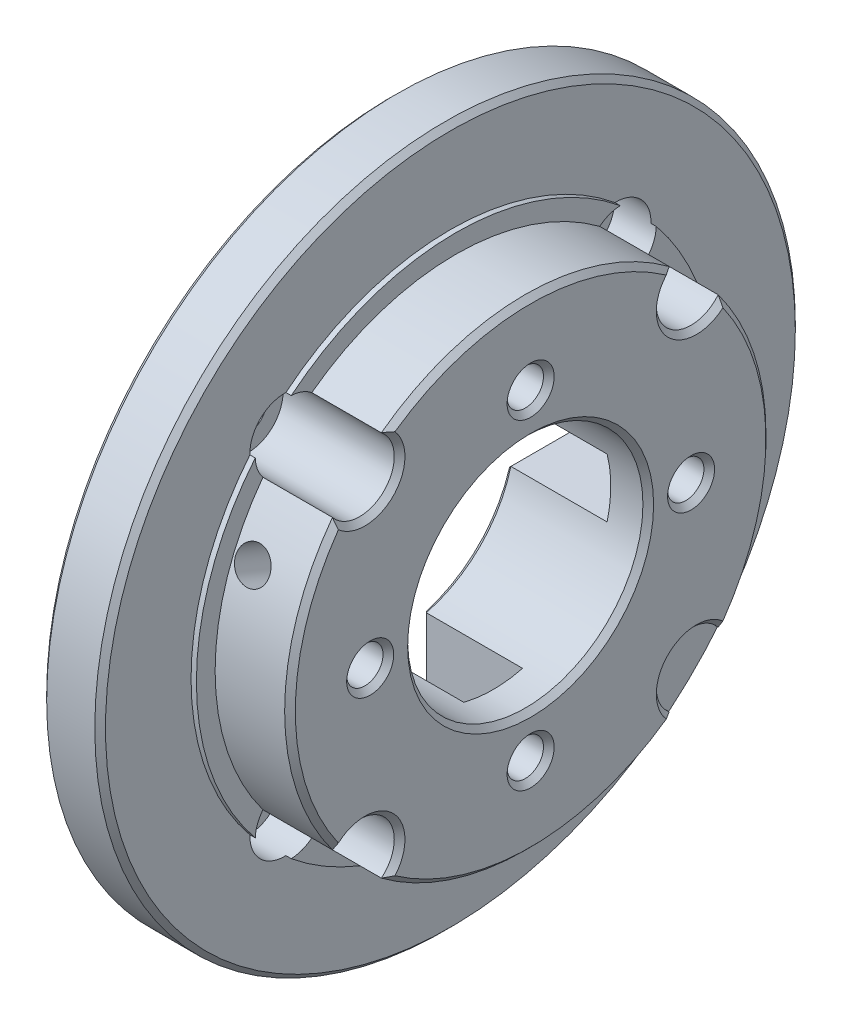
from build123d import *

# Parameters (mm, degrees)
M3_CLEARANCE_HOLE1_D                                = 3.4
SKETCH6_R                                           = 1.7
CUT_EXTRUDE1_DEPTH                                  = 9.5
CUT_EXTRUDE2_REACH                                  = 50.105
SKETCH7_R                                           = 3.25
CBORE_FOR_M3_HEX_SOCKET_HEAD_CAP_SCREW1_D           = 3.4
CBORE_FOR_M3_HEX_SOCKET_HEAD_CAP_SCREW1_CBORE_D     = 6.5
CBORE_FOR_M3_HEX_SOCKET_HEAD_CAP_SCREW1_CBORE_DEPTH = 3.4
CUT_EXTRUDE3_REACH                                  = 70.891
SKETCH12_R                                          = 1.6
CHAMFER1_SIZE                                       = 0.5


with BuildPart() as part:
    # Sketch1 → Revolve1 (revolve)
    with BuildSketch(Plane.XY, mode=Mode.PRIVATE) as revolve1_sk:
        Polygon((0, 32.75), (0, 11), (13, 11), (13, 22.5), (6, 22.5), (6, 24.25), (5.5, 24.25), (5.5, 32.75), align=None)
    revolve(revolve1_sk.sketch.rotate(Axis((0, 0, 0), (1, 0, 0)), 90), axis=Axis((0, 0, 0), (1, 0, 0)))

    # M3 Clearance Hole1 (through all)
    with Locations(Plane(origin=(13, 0, 0), x_dir=(0, 0, -1), z_dir=(1, 0, 0))):
        with Locations((0, 15), (15, 0), (0, -15), (-15, 0)):
            Hole(M3_CLEARANCE_HOLE1_D / 2)

    # Sketch6 → Cut-Extrude1 (cut)
    # profile 1 of 4: a face of its own
    with BuildSketch(Plane.ZY):
        with BuildLine():
            Line((2.75, 10.650704202), (2.75, 16.58771324))
            Line((2.75, 16.58771324), (0, 18.175426481))
            Line((0, 18.175426481), (-2.75, 16.58771324))
            Line((-2.75, 16.58771324), (-2.75, 10.650704202))
            ThreePointArc((-2.75, 10.650704202), (0, 11), (2.75, 10.650704202))
        make_face()
        with Locations(Location((0, 15, 0), (0, 0, 180))):
            Circle(SKETCH6_R, mode=Mode.SUBTRACT)
    # profile 2 of 4: a face of its own
    with BuildSketch(Plane.ZY):
        with BuildLine():
            ThreePointArc((-10.650704202, -2.75), (-11, 0), (-10.650704202, 2.75))
            Line((-10.650704202, 2.75), (-16.58771324, 2.75))
            Line((-16.58771324, 2.75), (-18.175426481, 0))
            Line((-18.175426481, 0), (-16.58771324, -2.75))
            Line((-16.58771324, -2.75), (-10.650704202, -2.75))
        make_face()
        with Locations(Location((-15, 0, 0), (0, 0, 180))):
            Circle(SKETCH6_R, mode=Mode.SUBTRACT)
    # profile 3 of 4: a face of its own
    with BuildSketch(Plane.ZY):
        with BuildLine():
            ThreePointArc((10.650704202, 2.75), (11, 0), (10.650704202, -2.75))
            Line((10.650704202, -2.75), (16.58771324, -2.75))
            Line((16.58771324, -2.75), (18.175426481, 0))
            Line((18.175426481, 0), (16.58771324, 2.75))
            Line((16.58771324, 2.75), (10.650704202, 2.75))
        make_face()
        with Locations(Location((15, 0, 0), (0, 0, 180))):
            Circle(SKETCH6_R, mode=Mode.SUBTRACT)
    # profile 4 of 4: a face of its own
    with BuildSketch(Plane.ZY):
        with BuildLine():
            ThreePointArc((2.75, -10.650704202), (0, -11), (-2.75, -10.650704202))
            Line((-2.75, -10.650704202), (-2.75, -16.58771324))
            Line((-2.75, -16.58771324), (0, -18.175426481))
            Line((0, -18.175426481), (2.75, -16.58771324))
            Line((2.75, -16.58771324), (2.75, -10.650704202))
        make_face()
        with Locations(Location((0, -15, 0), (0, 0, 180))):
            Circle(SKETCH6_R, mode=Mode.SUBTRACT)
    extrude(amount=-CUT_EXTRUDE1_DEPTH, mode=Mode.SUBTRACT)

    # Cut-Extrude2: up to this face of the body (flat: up to its plane)
    cut_extrude2_end = Plane(part.part.faces().sort_by_distance((5.5, 0, -25.176309883))[0])
    # Sketch7 → Cut-Extrude2 (cut, up to the picked face)
    with BuildSketch(Plane(origin=(13, 0, 0), x_dir=(0, 0, -1), z_dir=(1, 0, 0)), mode=Mode.PRIVATE) as cut_extrude2_sk1:
        with Locations((-15.5, 15.5)):
            Circle(SKETCH7_R)
    cut_extrude2_tool1 = split(extrude(cut_extrude2_sk1.sketch, amount=-CUT_EXTRUDE2_REACH, mode=Mode.PRIVATE), bisect_by=cut_extrude2_end, keep=Keep.BOTH, mode=Mode.PRIVATE)
    # Sketch7 → Cut-Extrude2 (cut, up to the picked face)
    with BuildSketch(Plane(origin=(13, 0, 0), x_dir=(0, 0, -1), z_dir=(1, 0, 0)), mode=Mode.PRIVATE) as cut_extrude2_sk2:
        with Locations((-15.5, -15.5)):
            Circle(SKETCH7_R)
    cut_extrude2_tool2 = split(extrude(cut_extrude2_sk2.sketch, amount=-CUT_EXTRUDE2_REACH, mode=Mode.PRIVATE), bisect_by=cut_extrude2_end, keep=Keep.BOTH, mode=Mode.PRIVATE)
    # Sketch7 → Cut-Extrude2 (cut, up to the picked face)
    with BuildSketch(Plane(origin=(13, 0, 0), x_dir=(0, 0, -1), z_dir=(1, 0, 0)), mode=Mode.PRIVATE) as cut_extrude2_sk3:
        with Locations((15.5, -15.5)):
            Circle(SKETCH7_R)
    cut_extrude2_tool3 = split(extrude(cut_extrude2_sk3.sketch, amount=-CUT_EXTRUDE2_REACH, mode=Mode.PRIVATE), bisect_by=cut_extrude2_end, keep=Keep.BOTH, mode=Mode.PRIVATE)
    # Sketch7 → Cut-Extrude2 (cut, up to the picked face)
    with BuildSketch(Plane(origin=(13, 0, 0), x_dir=(0, 0, -1), z_dir=(1, 0, 0)), mode=Mode.PRIVATE) as cut_extrude2_sk4:
        with Locations((15.5, 15.5)):
            Circle(SKETCH7_R)
    cut_extrude2_tool4 = split(extrude(cut_extrude2_sk4.sketch, amount=-CUT_EXTRUDE2_REACH, mode=Mode.PRIVATE), bisect_by=cut_extrude2_end, keep=Keep.BOTH, mode=Mode.PRIVATE)
    add(cut_extrude2_tool1.solids().sort_by(Axis((13, 15.5, 15.5), (-1, 0, 0)))[0], mode=Mode.SUBTRACT)
    add(cut_extrude2_tool2.solids().sort_by(Axis((13, -15.5, 15.5), (-1, 0, 0)))[0], mode=Mode.SUBTRACT)
    add(cut_extrude2_tool3.solids().sort_by(Axis((13, -15.5, -15.5), (-1, 0, 0)))[0], mode=Mode.SUBTRACT)
    add(cut_extrude2_tool4.solids().sort_by(Axis((13, 15.5, -15.5), (-1, 0, 0)))[0], mode=Mode.SUBTRACT)

    # CBORE for M3 Hex Socket Head Cap Screw1 (through all)
    with Locations(Plane(origin=(5.5, 0, 0), x_dir=(0, 0, -1), z_dir=(1, 0, 0))):
        with Locations((-15.5, 15.5), (15.5, 15.5), (15.5, -15.5), (-15.5, -15.5)):
            CounterBoreHole(CBORE_FOR_M3_HEX_SOCKET_HEAD_CAP_SCREW1_D / 2, CBORE_FOR_M3_HEX_SOCKET_HEAD_CAP_SCREW1_CBORE_D / 2, CBORE_FOR_M3_HEX_SOCKET_HEAD_CAP_SCREW1_CBORE_DEPTH)

    # Sketch12 → Cut-Extrude3 (cut, up to next)
    with BuildSketch(Plane(origin=(0, 8.610377228, 20.787289482), x_dir=(-1, 0, 0), z_dir=(0, 0.38268343236508734, 0.9238795325112877)), mode=Mode.PRIVATE) as cut_extrude3_sk1:
        with Locations(Location((-7.8, 0, 0), (0, 0, 90))):
            Circle(SKETCH12_R)
    cut_extrude3_tool1 = extrude(cut_extrude3_sk1.sketch, amount=-CUT_EXTRUDE3_REACH, mode=Mode.PRIVATE) & part.part
    add(cut_extrude3_tool1.solids().sort_by_distance((7.8, 8.610377, 20.787289))[0], mode=Mode.SUBTRACT)

    # Chamfer1
    chamfer1_edges = [part.edges().sort_by_distance(p)[0] for p in [
        (13, 0, -11),
        (13, 22.5, 0),
        (13, 0, -22.5),
        (13, -22.5, 0),
        (13, 0, 22.5),
        (13, -13.201902961, 13.201902961),
        (13, -13.201902961, -13.201902961),
        (13, 13.201902961, -13.201902961),
        (13, 13.201902961, 13.201902961),
        (13, 15, -1.7),
        (13, 0, 13.3),
        (13, -15, -1.7),
        (13, 0, -16.7),
        (0, 7.778174593, -7.778174593),
        (0, -7.778174593, -7.778174593),
        (0, -7.778174593, 7.778174593),
        (0, 13.619208721, -2.75),
        (0, 13.619208721, 2.75),
        (0, 17.38156986, 1.375),
        (0, 17.38156986, -1.375),
        (0, 2.75, 13.619208721),
        (0, -2.75, 13.619208721),
        (0, -1.375, 17.38156986),
        (0, 1.375, 17.38156986),
        (0, 7.778174593, 7.778174593),
        (0, -13.619208721, -2.75),
        (0, -17.38156986, -1.375),
        (0, -17.38156986, 1.375),
        (0, -13.619208721, 2.75),
        (0, 0, -32.75),
        (5.5, 0, -32.75),
        (0, 2.75, -13.619208721),
        (0, 1.375, -17.38156986),
        (0, -1.375, -17.38156986),
        (0, -2.75, -13.619208721),
    ]]
    chamfer(chamfer1_edges, length=CHAMFER1_SIZE)


solid = part.part
